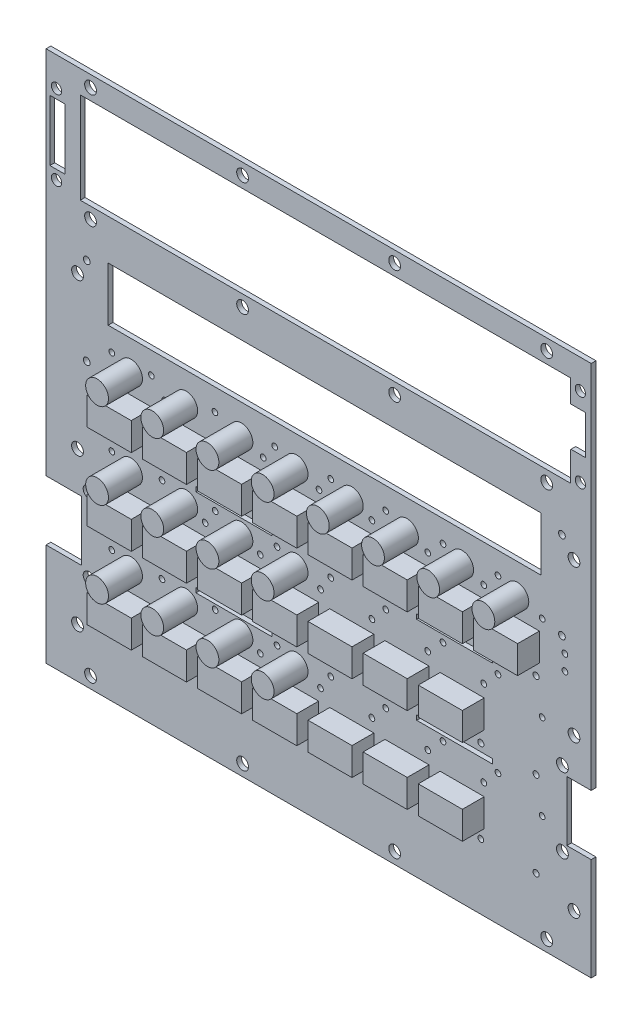
from build123d import *

# Parameters (mm, degrees)
SKETCH1_W                       = 144.56156
SKETCH1_H                       = 18.00098
SKETCH1_W_2                     = 5.08
SKETCH1_H_2                     = 20.32
SKETCH1_W_3                     = 25.4
SKETCH1_H_3                     = 1.5875
BOARD_DEPTH                     = 1.592072
SKETCH11_R                      = 3.81
LED_KINGBRIGHT_3P_2P54_10_DEPTH = 11.3538
SKETCH12_R                      = 3.81
LED_KINGBRIGHT_3P_2P54_11_DEPTH = 11.3538
SKETCH13_R                      = 3.81
LED_KINGBRIGHT_3P_2P54_12_DEPTH = 11.3538
SKETCH14_R                      = 3.81
LED_KINGBRIGHT_3P_2P54_13_DEPTH = 11.3538
SKETCH15_R                      = 3.81
LED_KINGBRIGHT_3P_2P54_14_DEPTH = 11.3538
SKETCH16_R                      = 3.81
LED_KINGBRIGHT_3P_2P54_15_DEPTH = 11.3538
SKETCH17_R                      = 3.81
LED_KINGBRIGHT_3P_2P54_16_DEPTH = 11.3538
SKETCH18_R                      = 3.81
LED_KINGBRIGHT_3P_2P54_17_DEPTH = 11.3538
SKETCH19_R                      = 3.81
LED_KINGBRIGHT_3P_2P54_18_DEPTH = 11.3538
SKETCH20_R                      = 3.81
LED_KINGBRIGHT_3P_2P54_19_DEPTH = 11.3538
SKETCH21_R                      = 3.81
LED_KINGBRIGHT_3P_2P54_20_DEPTH = 11.3538
SKETCH22_R                      = 3.81
LED_KINGBRIGHT_3P_2P54_21_DEPTH = 11.3538
SKETCH23_R                      = 3.81
LED_KINGBRIGHT_3P_2P54_22_DEPTH = 11.3538
SKETCH24_R                      = 3.81
LED_KINGBRIGHT_3P_2P54_23_DEPTH = 11.3538
SKETCH25_R                      = 3.81
LED_KINGBRIGHT_3P_2P54_24_DEPTH = 11.3538
SKETCH26_R                      = 3.81
LED_KINGBRIGHT_3P_2P54_25_DEPTH = 11.3538
SKETCH29_W                      = 14.732
SKETCH29_H                      = 9.271
SWITCH_MCDTS2_3_DEPTH           = 7.3000108
SKETCH30_W                      = 14.732
SKETCH30_H                      = 9.271
SWITCH_MCDTS2_4_DEPTH           = 7.3000108
SKETCH31_W                      = 14.732
SKETCH31_H                      = 9.271
SWITCH_MCDTS2_5_DEPTH           = 7.3000108
SKETCH32_W                      = 14.732
SKETCH32_H                      = 9.271
SWITCH_MCDTS2_6_DEPTH           = 7.3000108
SKETCH33_W                      = 14.732
SKETCH33_H                      = 9.271
SWITCH_MCDTS2_7_DEPTH           = 7.3000108
SKETCH34_W                      = 14.732
SKETCH34_H                      = 9.271
SWITCH_MCDTS2_8_DEPTH           = 7.3000108
SKETCH35_W                      = 14.732
SKETCH35_H                      = 9.271
SWITCH_MCDTS2_9_DEPTH           = 7.3000108
SKETCH36_W                      = 14.732
SKETCH36_H                      = 9.271
SWITCH_MCDTS2_10_DEPTH          = 7.3000108
SKETCH37_W                      = 14.732
SKETCH37_H                      = 9.271
SWITCH_MCDTS2_11_DEPTH          = 7.3000108
SKETCH38_W                      = 14.732
SKETCH38_H                      = 9.271
SWITCH_MCDTS2_12_DEPTH          = 7.3000108
SKETCH39_W                      = 14.732
SKETCH39_H                      = 9.271
SWITCH_MCDTS2_13_DEPTH          = 7.3000108
SKETCH40_W                      = 14.732
SKETCH40_H                      = 9.271
SWITCH_MCDTS2_14_DEPTH          = 7.3000108
SKETCH41_W                      = 14.732
SKETCH41_H                      = 9.271
SWITCH_MCDTS2_15_DEPTH          = 7.3000108
SKETCH42_W                      = 14.732
SKETCH42_H                      = 9.271
SWITCH_MCDTS2_16_DEPTH          = 7.3000108
SKETCH43_W                      = 14.732
SKETCH43_H                      = 9.271
SWITCH_MCDTS2_17_DEPTH          = 7.3000108
SKETCH44_W                      = 14.732
SKETCH44_H                      = 9.271
SWITCH_MCDTS2_18_DEPTH          = 7.3000108
SKETCH45_W                      = 14.732
SKETCH45_H                      = 9.271
SWITCH_MCDTS2_19_DEPTH          = 7.3000108
SKETCH46_W                      = 14.732
SKETCH46_H                      = 9.271
SWITCH_MCDTS2_20_DEPTH          = 7.3000108
SKETCH47_W                      = 14.732
SKETCH47_H                      = 9.271
SWITCH_MCDTS2_21_DEPTH          = 7.3000108
SKETCH48_W                      = 14.732
SKETCH48_H                      = 9.271
SWITCH_MCDTS2_22_DEPTH          = 7.3000108
SKETCH49_W                      = 14.732
SKETCH49_H                      = 9.271
SWITCH_MCDTS2_23_DEPTH          = 7.3000108
SKETCH50_W                      = 14.732
SKETCH50_H                      = 9.271
SWITCH_MCDTS2_24_DEPTH          = 7.3000108
SKETCH56_R                      = 1.016
SKETCH56_R_2                    = 0.9652
SKETCH56_R_3                    = 0.9525
SKETCH56_R_4                    = 1.9685
SKETCH56_R_5                    = 1.1303
SKETCH56_R_6                    = 1.7145
CUT_EXTRUDE1_DEPTH              = 10


with BuildPart() as part:
    # Sketch1 → BOARD (new body)
    with BuildSketch(Plane.XY):
        Polygon((0, 0), (182.118, 0), (182.118, 34.24682), (173.98746, 34.24682), (173.98746, 54.24678), (182.118, 54.24678), (182.118, 177.8), (0, 177.8), (0, 54.24678), (11.86942, 54.24678), (11.86942, 34.24682), (0, 34.24682), align=None)
        with Locations((93.01988, 117.17909)):
            Rectangle(SKETCH1_W, SKETCH1_H, mode=Mode.SUBTRACT)
        with Locations((3.81, 154.813)):
            Rectangle(SKETCH1_W_2, SKETCH1_H_2, mode=Mode.SUBTRACT)
        Polygon((12.7, 170.18), (175.26, 170.18), (175.26, 162.6616), (180.086, 162.6616), (180.2892, 162.4584), (180.2892, 149.606), (175.3616, 149.606), (175.26, 149.5044), (175.26, 139.7), (12.7, 139.7), (11.43, 139.7), (11.43, 170.18), align=None, mode=Mode.SUBTRACT)
        with Locations((62.7634, 46.20895)):
            Rectangle(SKETCH1_W_3, SKETCH1_H_3, mode=Mode.SUBTRACT)
        with Locations((136.5134176, 46.20895)):
            Rectangle(SKETCH1_W_3, SKETCH1_H_3, mode=Mode.SUBTRACT)
        with Locations((136.5134176, 75.41895)):
            Rectangle(SKETCH1_W_3, SKETCH1_H_3, mode=Mode.SUBTRACT)
        with Locations((62.7634, 75.41895)):
            Rectangle(SKETCH1_W_3, SKETCH1_H_3, mode=Mode.SUBTRACT)
    extrude(amount=BOARD_DEPTH)

    # Sketch56 → Cut-Extrude1 (cut)
    with BuildSketch(Plane.XY.offset(1.592072)):
        with Locations((163.703, 21.1074)):
            Circle(SKETCH56_R)
        with Locations((163.703, 49.6824)):
            Circle(SKETCH56_R)
        with Locations((145.2626, 21.8186)):
            Circle(SKETCH56_R_2)
        with Locations((126.8476, 21.6154)):
            Circle(SKETCH56_R_2)
        with Locations((108.4072, 21.7424)):
            Circle(SKETCH56_R_2)
        with Locations((89.9668, 21.844)):
            Circle(SKETCH56_R_2)
        with Locations((71.5264, 20.7772)):
            Circle(SKETCH56_R_2)
        with Locations((53.086, 21.1582)):
            Circle(SKETCH56_R_2)
        with Locations((34.6472002, 21.1328)):
            Circle(SKETCH56_R)
        with Locations((145.2626, 49.5554)):
            Circle(SKETCH56_R)
        with Locations((126.8222, 49.3522)):
            Circle(SKETCH56_R)
        with Locations((108.3818, 49.1236)):
            Circle(SKETCH56_R)
        with Locations((89.9414, 49.6824)):
            Circle(SKETCH56_R)
        with Locations((71.501, 49.1998)):
            Circle(SKETCH56_R)
        with Locations((53.0606, 49.1998)):
            Circle(SKETCH56_R)
        with Locations((34.6202, 49.276)):
            Circle(SKETCH56_R)
        with Locations((163.703, 78.2574)):
            Circle(SKETCH56_R)
        with Locations((145.2626, 77.7748)):
            Circle(SKETCH56_R)
        with Locations((126.746, 78.3336)):
            Circle(SKETCH56_R)
        with Locations((108.3818, 78.74)):
            Circle(SKETCH56_R)
        with Locations((89.9414, 78.3336)):
            Circle(SKETCH56_R)
        with Locations((71.501, 78.2574)):
            Circle(SKETCH56_R)
        with Locations((53.0606, 78.4098)):
            Circle(SKETCH56_R)
        with Locations((34.6202, 78.0542)):
            Circle(SKETCH56_R)
        with Locations((91.694, 38.6588)):
            Circle(SKETCH56_R_3)
        with Locations((77.1652, 43.7388)):
            Circle(SKETCH56_R_3)
        with Locations((71.5772, 38.6588)):
            Circle(SKETCH56_R_3)
        with Locations((56.4896, 43.7388)):
            Circle(SKETCH56_R_3)
        with Locations((38.735, 43.7388)):
            Circle(SKETCH56_R_3)
        with Locations((21.8948, 38.6588)):
            Circle(SKETCH56_R_3)
        with Locations((21.971, 43.7388)):
            Circle(SKETCH56_R_3)
        with Locations((77.1652, 72.3138)):
            Circle(SKETCH56_R_3)
        with Locations((91.694, 67.2338)):
            Circle(SKETCH56_R_3)
        with Locations((71.5772, 67.2338)):
            Circle(SKETCH56_R_3)
        with Locations((56.4896, 72.3138)):
            Circle(SKETCH56_R_3)
        with Locations((53.1368, 67.2338)):
            Circle(SKETCH56_R_3)
        with Locations((38.735, 72.3138)):
            Circle(SKETCH56_R_3)
        with Locations((21.8948, 67.2338)):
            Circle(SKETCH56_R_3)
        with Locations((21.971, 72.3138)):
            Circle(SKETCH56_R_3)
        with Locations((165.735, 95.8088)):
            Circle(SKETCH56_R_3)
        with Locations((150.9776, 100.8888)):
            Circle(SKETCH56_R_3)
        with Locations((146.2278, 95.8088)):
            Circle(SKETCH56_R_3)
        with Locations((132.6134, 100.8888)):
            Circle(SKETCH56_R_3)
        with Locations((113.4872, 100.8888)):
            Circle(SKETCH56_R_3)
        with Locations((127.508, 95.8088)):
            Circle(SKETCH56_R_3)
        with Locations((108.8644, 95.8088)):
            Circle(SKETCH56_R_3)
        with Locations((95.0976, 100.8888)):
            Circle(SKETCH56_R_3)
        with Locations((91.186, 95.8088)):
            Circle(SKETCH56_R_3)
        with Locations((76.3778, 100.8888)):
            Circle(SKETCH56_R_3)
        with Locations((72.5424, 95.8088)):
            Circle(SKETCH56_R_3)
        with Locations((56.4134, 100.8888)):
            Circle(SKETCH56_R_3)
        with Locations((39.7256, 95.8088)):
            Circle(SKETCH56_R_3)
        with Locations((35.179, 100.8888)):
            Circle(SKETCH56_R_3)
        with Locations((24.2062, 95.8088)):
            Circle(SKETCH56_R_3)
        with Locations((21.971, 100.8888)):
            Circle(SKETCH56_R_3)
        with Locations((132.6134, 72.3138)):
            Circle(SKETCH56_R_3)
        with Locations((146.2278, 67.2338)):
            Circle(SKETCH56_R_3)
        with Locations((113.4872, 72.3138)):
            Circle(SKETCH56_R_3)
        with Locations((127.508, 67.2338)):
            Circle(SKETCH56_R_3)
        with Locations((95.0976, 72.3138)):
            Circle(SKETCH56_R_3)
        with Locations((108.8644, 67.2338)):
            Circle(SKETCH56_R_3)
        with Locations((150.9776, 43.7388)):
            Circle(SKETCH56_R_3)
        with Locations((132.6134, 43.7388)):
            Circle(SKETCH56_R_3)
        with Locations((113.4872, 43.7388)):
            Circle(SKETCH56_R_3)
        with Locations((95.0976, 43.7388)):
            Circle(SKETCH56_R_3)
        with Locations((108.8644, 38.6588)):
            Circle(SKETCH56_R_3)
        with Locations((150.9776, 72.3138)):
            Circle(SKETCH56_R_3)
        with Locations((165.735, 67.2338)):
            Circle(SKETCH56_R_3)
        with Locations((173.3296, 89.4588)):
            Circle(SKETCH56_R_3)
        with Locations((173.355, 84.3534)):
            Circle(SKETCH56_R_3)
        with Locations((176.37252, 118.11)):
            Circle(SKETCH56_R_4)
        with Locations((176.37252, 67.31)):
            Circle(SKETCH56_R_4)
        with Locations((176.37252, 16.51)):
            Circle(SKETCH56_R_4)
        with Locations((167.259, 135.89)):
            Circle(SKETCH56_R_4)
        with Locations((116.459, 135.89)):
            Circle(SKETCH56_R_4)
        with Locations((65.659, 135.89)):
            Circle(SKETCH56_R_4)
        with Locations((14.859, 135.89)):
            Circle(SKETCH56_R_4)
        with Locations((10.51052, 118.11)):
            Circle(SKETCH56_R_4)
        with Locations((10.51052, 67.31)):
            Circle(SKETCH56_R_4)
        with Locations((10.51052, 16.51)):
            Circle(SKETCH56_R_4)
        with Locations((165.735, 38.6588)):
            Circle(SKETCH56_R_3)
        with Locations((146.2278, 38.6588)):
            Circle(SKETCH56_R_3)
        with Locations((127.508, 38.6588)):
            Circle(SKETCH56_R_3)
        with Locations((14.859, 173.99)):
            Circle(SKETCH56_R_4)
        with Locations((65.659, 173.99)):
            Circle(SKETCH56_R_4)
        with Locations((116.459, 173.99)):
            Circle(SKETCH56_R_4)
        with Locations((167.259, 173.99)):
            Circle(SKETCH56_R_4)
        with Locations((167.259, 3.81)):
            Circle(SKETCH56_R_4)
        with Locations((116.459, 3.81)):
            Circle(SKETCH56_R_4)
        with Locations((65.659, 3.81)):
            Circle(SKETCH56_R_4)
        with Locations((14.859, 3.81)):
            Circle(SKETCH56_R_4)
        with Locations((172.50664, 56.7436)):
            Circle(SKETCH56_R_4)
        with Locations((172.50664, 31.75)):
            Circle(SKETCH56_R_4)
        with Locations((14.36878, 56.7436)):
            Circle(SKETCH56_R_4)
        with Locations((14.36878, 31.75)):
            Circle(SKETCH56_R_4)
        with Locations((172.34154, 123.37542)):
            Circle(SKETCH56_R_5)
        with Locations((172.34154, 94.16542)):
            Circle(SKETCH56_R_5)
        with Locations((13.59154, 94.16542)):
            Circle(SKETCH56_R_5)
        with Locations((13.59154, 123.37542)):
            Circle(SKETCH56_R_5)
        with Locations((178.51374, 141.56182)):
            Circle(SKETCH56_R_6)
        with Locations((178.51374, 168.06164)):
            Circle(SKETCH56_R_6)
        with Locations((3.50012, 168.06164)):
            Circle(SKETCH56_R_6)
        with Locations((3.50012, 141.56182)):
            Circle(SKETCH56_R_6)
    extrude(amount=-CUT_EXTRUDE1_DEPTH, mode=Mode.SUBTRACT)


with BuildPart() as body_2:
    # Sketch11 → LED-KINGBRIGHT_3P_2P54-10 (new body)
    with BuildSketch(Plane.XY.offset(1.592072)):
        with Locations((83.7097132, 41.1988)):
            Circle(SKETCH11_R)
    extrude(amount=LED_KINGBRIGHT_3P_2P54_10_DEPTH)


with BuildPart() as body_3:
    # Sketch12 → LED-KINGBRIGHT_3P_2P54-11 (new body)
    with BuildSketch(Plane.XY.offset(1.592072)):
        with Locations((65.2722088, 41.1988)):
            Circle(SKETCH12_R)
    extrude(amount=LED_KINGBRIGHT_3P_2P54_11_DEPTH)


with BuildPart() as body_4:
    # Sketch13 → LED-KINGBRIGHT_3P_2P54-12 (new body)
    with BuildSketch(Plane.XY.offset(1.592072)):
        with Locations((46.8347044, 41.1988)):
            Circle(SKETCH13_R)
    extrude(amount=LED_KINGBRIGHT_3P_2P54_12_DEPTH)


with BuildPart() as body_5:
    # Sketch14 → LED-KINGBRIGHT_3P_2P54-13 (new body)
    with BuildSketch(Plane.XY.offset(1.592072)):
        with Locations((28.3972, 41.1988)):
            Circle(SKETCH14_R)
    extrude(amount=LED_KINGBRIGHT_3P_2P54_13_DEPTH)


with BuildPart() as body_6:
    # Sketch15 → LED-KINGBRIGHT_3P_2P54-14 (new body)
    with BuildSketch(Plane.XY.offset(1.592072)):
        with Locations((83.7097132, 69.7738)):
            Circle(SKETCH15_R)
    extrude(amount=LED_KINGBRIGHT_3P_2P54_14_DEPTH)


with BuildPart() as body_7:
    # Sketch16 → LED-KINGBRIGHT_3P_2P54-15 (new body)
    with BuildSketch(Plane.XY.offset(1.592072)):
        with Locations((65.2722088, 69.7738)):
            Circle(SKETCH16_R)
    extrude(amount=LED_KINGBRIGHT_3P_2P54_15_DEPTH)


with BuildPart() as body_8:
    # Sketch17 → LED-KINGBRIGHT_3P_2P54-16 (new body)
    with BuildSketch(Plane.XY.offset(1.592072)):
        with Locations((46.8347044, 69.7738)):
            Circle(SKETCH17_R)
    extrude(amount=LED_KINGBRIGHT_3P_2P54_16_DEPTH)


with BuildPart() as body_9:
    # Sketch18 → LED-KINGBRIGHT_3P_2P54-17 (new body)
    with BuildSketch(Plane.XY.offset(1.592072)):
        with Locations((28.3972, 69.7738)):
            Circle(SKETCH18_R)
    extrude(amount=LED_KINGBRIGHT_3P_2P54_17_DEPTH)


with BuildPart() as body_10:
    # Sketch19 → LED-KINGBRIGHT_3P_2P54-18 (new body)
    with BuildSketch(Plane.XY.offset(1.592072)):
        with Locations((157.4597308, 98.3488)):
            Circle(SKETCH19_R)
    extrude(amount=LED_KINGBRIGHT_3P_2P54_18_DEPTH)


with BuildPart() as body_11:
    # Sketch20 → LED-KINGBRIGHT_3P_2P54-19 (new body)
    with BuildSketch(Plane.XY.offset(1.592072)):
        with Locations((139.0222264, 98.3488)):
            Circle(SKETCH20_R)
    extrude(amount=LED_KINGBRIGHT_3P_2P54_19_DEPTH)


with BuildPart() as body_12:
    # Sketch21 → LED-KINGBRIGHT_3P_2P54-20 (new body)
    with BuildSketch(Plane.XY.offset(1.592072)):
        with Locations((120.584722, 98.3488)):
            Circle(SKETCH21_R)
    extrude(amount=LED_KINGBRIGHT_3P_2P54_20_DEPTH)


with BuildPart() as body_13:
    # Sketch22 → LED-KINGBRIGHT_3P_2P54-21 (new body)
    with BuildSketch(Plane.XY.offset(1.592072)):
        with Locations((102.1472176, 98.3488)):
            Circle(SKETCH22_R)
    extrude(amount=LED_KINGBRIGHT_3P_2P54_21_DEPTH)


with BuildPart() as body_14:
    # Sketch23 → LED-KINGBRIGHT_3P_2P54-22 (new body)
    with BuildSketch(Plane.XY.offset(1.592072)):
        with Locations((83.7097132, 98.3488)):
            Circle(SKETCH23_R)
    extrude(amount=LED_KINGBRIGHT_3P_2P54_22_DEPTH)


with BuildPart() as body_15:
    # Sketch24 → LED-KINGBRIGHT_3P_2P54-23 (new body)
    with BuildSketch(Plane.XY.offset(1.592072)):
        with Locations((65.2722088, 98.3488)):
            Circle(SKETCH24_R)
    extrude(amount=LED_KINGBRIGHT_3P_2P54_23_DEPTH)


with BuildPart() as body_16:
    # Sketch25 → LED-KINGBRIGHT_3P_2P54-24 (new body)
    with BuildSketch(Plane.XY.offset(1.592072)):
        with Locations((46.8347044, 98.3488)):
            Circle(SKETCH25_R)
    extrude(amount=LED_KINGBRIGHT_3P_2P54_24_DEPTH)


with BuildPart() as body_17:
    # Sketch26 → LED-KINGBRIGHT_3P_2P54-25 (new body)
    with BuildSketch(Plane.XY.offset(1.592072)):
        with Locations((28.3972, 98.3488)):
            Circle(SKETCH26_R)
    extrude(amount=LED_KINGBRIGHT_3P_2P54_25_DEPTH)


with BuildPart() as body_18:
    # Sketch29 → SWITCH-MCDTS2-3 (new body)
    with BuildSketch(Plane.XY.offset(1.592072)):
        with Locations((139.0222264, 29.9593)):
            Rectangle(SKETCH29_W, SKETCH29_H)
    extrude(amount=SWITCH_MCDTS2_3_DEPTH)


with BuildPart() as body_19:
    # Sketch30 → SWITCH-MCDTS2-4 (new body)
    with BuildSketch(Plane.XY.offset(1.592072)):
        with Locations((120.584722, 29.9593)):
            Rectangle(SKETCH30_W, SKETCH30_H)
    extrude(amount=SWITCH_MCDTS2_4_DEPTH)


with BuildPart() as body_20:
    # Sketch31 → SWITCH-MCDTS2-5 (new body)
    with BuildSketch(Plane.XY.offset(1.592072)):
        with Locations((102.1472176, 29.9593)):
            Rectangle(SKETCH31_W, SKETCH31_H)
    extrude(amount=SWITCH_MCDTS2_5_DEPTH)


with BuildPart() as body_21:
    # Sketch32 → SWITCH-MCDTS2-6 (new body)
    with BuildSketch(Plane.XY.offset(1.592072)):
        with Locations((83.7097132, 29.9593)):
            Rectangle(SKETCH32_W, SKETCH32_H)
    extrude(amount=SWITCH_MCDTS2_6_DEPTH)


with BuildPart() as body_22:
    # Sketch33 → SWITCH-MCDTS2-7 (new body)
    with BuildSketch(Plane.XY.offset(1.592072)):
        with Locations((65.2722088, 29.9593)):
            Rectangle(SKETCH33_W, SKETCH33_H)
    extrude(amount=SWITCH_MCDTS2_7_DEPTH)


with BuildPart() as body_23:
    # Sketch34 → SWITCH-MCDTS2-8 (new body)
    with BuildSketch(Plane.XY.offset(1.592072)):
        with Locations((46.8347044, 29.9593)):
            Rectangle(SKETCH34_W, SKETCH34_H)
    extrude(amount=SWITCH_MCDTS2_8_DEPTH)


with BuildPart() as body_24:
    # Sketch35 → SWITCH-MCDTS2-9 (new body)
    with BuildSketch(Plane.XY.offset(1.592072)):
        with Locations((28.3972, 29.9593)):
            Rectangle(SKETCH35_W, SKETCH35_H)
    extrude(amount=SWITCH_MCDTS2_9_DEPTH)


with BuildPart() as body_25:
    # Sketch36 → SWITCH-MCDTS2-10 (new body)
    with BuildSketch(Plane.XY.offset(1.592072)):
        with Locations((139.0222264, 58.5343)):
            Rectangle(SKETCH36_W, SKETCH36_H)
    extrude(amount=SWITCH_MCDTS2_10_DEPTH)


with BuildPart() as body_26:
    # Sketch37 → SWITCH-MCDTS2-11 (new body)
    with BuildSketch(Plane.XY.offset(1.592072)):
        with Locations((120.584722, 58.5343)):
            Rectangle(SKETCH37_W, SKETCH37_H)
    extrude(amount=SWITCH_MCDTS2_11_DEPTH)


with BuildPart() as body_27:
    # Sketch38 → SWITCH-MCDTS2-12 (new body)
    with BuildSketch(Plane.XY.offset(1.592072)):
        with Locations((102.1472176, 58.5343)):
            Rectangle(SKETCH38_W, SKETCH38_H)
    extrude(amount=SWITCH_MCDTS2_12_DEPTH)


with BuildPart() as body_28:
    # Sketch39 → SWITCH-MCDTS2-13 (new body)
    with BuildSketch(Plane.XY.offset(1.592072)):
        with Locations((83.7097132, 58.5343)):
            Rectangle(SKETCH39_W, SKETCH39_H)
    extrude(amount=SWITCH_MCDTS2_13_DEPTH)


with BuildPart() as body_29:
    # Sketch40 → SWITCH-MCDTS2-14 (new body)
    with BuildSketch(Plane.XY.offset(1.592072)):
        with Locations((65.2722088, 58.5343)):
            Rectangle(SKETCH40_W, SKETCH40_H)
    extrude(amount=SWITCH_MCDTS2_14_DEPTH)


with BuildPart() as body_30:
    # Sketch41 → SWITCH-MCDTS2-15 (new body)
    with BuildSketch(Plane.XY.offset(1.592072)):
        with Locations((46.8347044, 58.5343)):
            Rectangle(SKETCH41_W, SKETCH41_H)
    extrude(amount=SWITCH_MCDTS2_15_DEPTH)


with BuildPart() as body_31:
    # Sketch42 → SWITCH-MCDTS2-16 (new body)
    with BuildSketch(Plane.XY.offset(1.592072)):
        with Locations((28.3972, 58.5343)):
            Rectangle(SKETCH42_W, SKETCH42_H)
    extrude(amount=SWITCH_MCDTS2_16_DEPTH)


with BuildPart() as body_32:
    # Sketch43 → SWITCH-MCDTS2-17 (new body)
    with BuildSketch(Plane.XY.offset(1.592072)):
        with Locations((157.4597308, 87.1093)):
            Rectangle(SKETCH43_W, SKETCH43_H)
    extrude(amount=SWITCH_MCDTS2_17_DEPTH)


with BuildPart() as body_33:
    # Sketch44 → SWITCH-MCDTS2-18 (new body)
    with BuildSketch(Plane.XY.offset(1.592072)):
        with Locations((139.0222264, 87.1093)):
            Rectangle(SKETCH44_W, SKETCH44_H)
    extrude(amount=SWITCH_MCDTS2_18_DEPTH)


with BuildPart() as body_34:
    # Sketch45 → SWITCH-MCDTS2-19 (new body)
    with BuildSketch(Plane.XY.offset(1.592072)):
        with Locations((120.584722, 87.1093)):
            Rectangle(SKETCH45_W, SKETCH45_H)
    extrude(amount=SWITCH_MCDTS2_19_DEPTH)


with BuildPart() as body_35:
    # Sketch46 → SWITCH-MCDTS2-20 (new body)
    with BuildSketch(Plane.XY.offset(1.592072)):
        with Locations((102.1472176, 87.1093)):
            Rectangle(SKETCH46_W, SKETCH46_H)
    extrude(amount=SWITCH_MCDTS2_20_DEPTH)


with BuildPart() as body_36:
    # Sketch47 → SWITCH-MCDTS2-21 (new body)
    with BuildSketch(Plane.XY.offset(1.592072)):
        with Locations((83.7097132, 87.1093)):
            Rectangle(SKETCH47_W, SKETCH47_H)
    extrude(amount=SWITCH_MCDTS2_21_DEPTH)


with BuildPart() as body_37:
    # Sketch48 → SWITCH-MCDTS2-22 (new body)
    with BuildSketch(Plane.XY.offset(1.592072)):
        with Locations((65.2722088, 87.1093)):
            Rectangle(SKETCH48_W, SKETCH48_H)
    extrude(amount=SWITCH_MCDTS2_22_DEPTH)


with BuildPart() as body_38:
    # Sketch49 → SWITCH-MCDTS2-23 (new body)
    with BuildSketch(Plane.XY.offset(1.592072)):
        with Locations((46.8347044, 87.1093)):
            Rectangle(SKETCH49_W, SKETCH49_H)
    extrude(amount=SWITCH_MCDTS2_23_DEPTH)


with BuildPart() as body_39:
    # Sketch50 → SWITCH-MCDTS2-24 (new body)
    with BuildSketch(Plane.XY.offset(1.592072)):
        with Locations((28.3972, 87.1093)):
            Rectangle(SKETCH50_W, SKETCH50_H)
    extrude(amount=SWITCH_MCDTS2_24_DEPTH)


solid = Compound([part.part, body_2.part, body_3.part, body_4.part, body_5.part, body_6.part, body_7.part, body_8.part, body_9.part, body_10.part, body_11.part, body_12.part, body_13.part, body_14.part, body_15.part, body_16.part, body_17.part, body_18.part, body_19.part, body_20.part, body_21.part, body_22.part, body_23.part, body_24.part, body_25.part, body_26.part, body_27.part, body_28.part, body_29.part, body_30.part, body_31.part, body_32.part, body_33.part, body_34.part, body_35.part, body_36.part, body_37.part, body_38.part, body_39.part])
